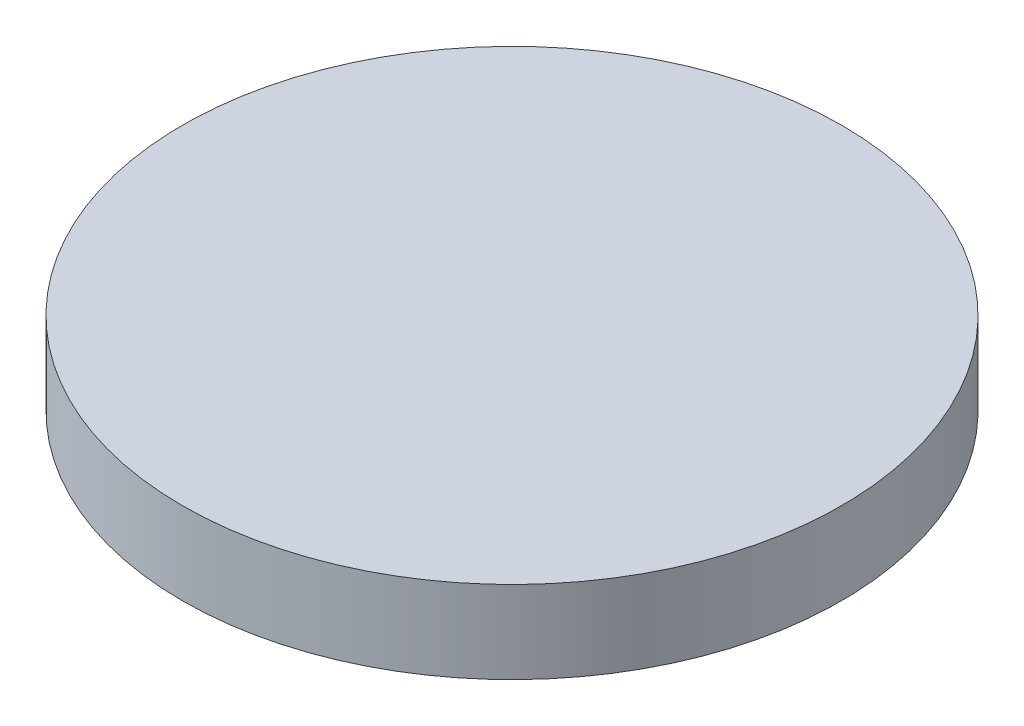
from build123d import *

# Parameters (mm, degrees)
CROQUIS1_R              = 40
SALIENTE_EXTRUIR1_DEPTH = 10


with BuildPart() as part:
    # Croquis1 → Saliente-Extruir1 (new body)
    with BuildSketch(Plane(origin=(0, 0, 0), x_dir=(1, 0, 0), z_dir=(0, 1, 0))):
        with Locations(Location((0, 0, 0), (0, 0, 270))):
            Circle(CROQUIS1_R)
    extrude(amount=SALIENTE_EXTRUIR1_DEPTH)


solid = part.part
